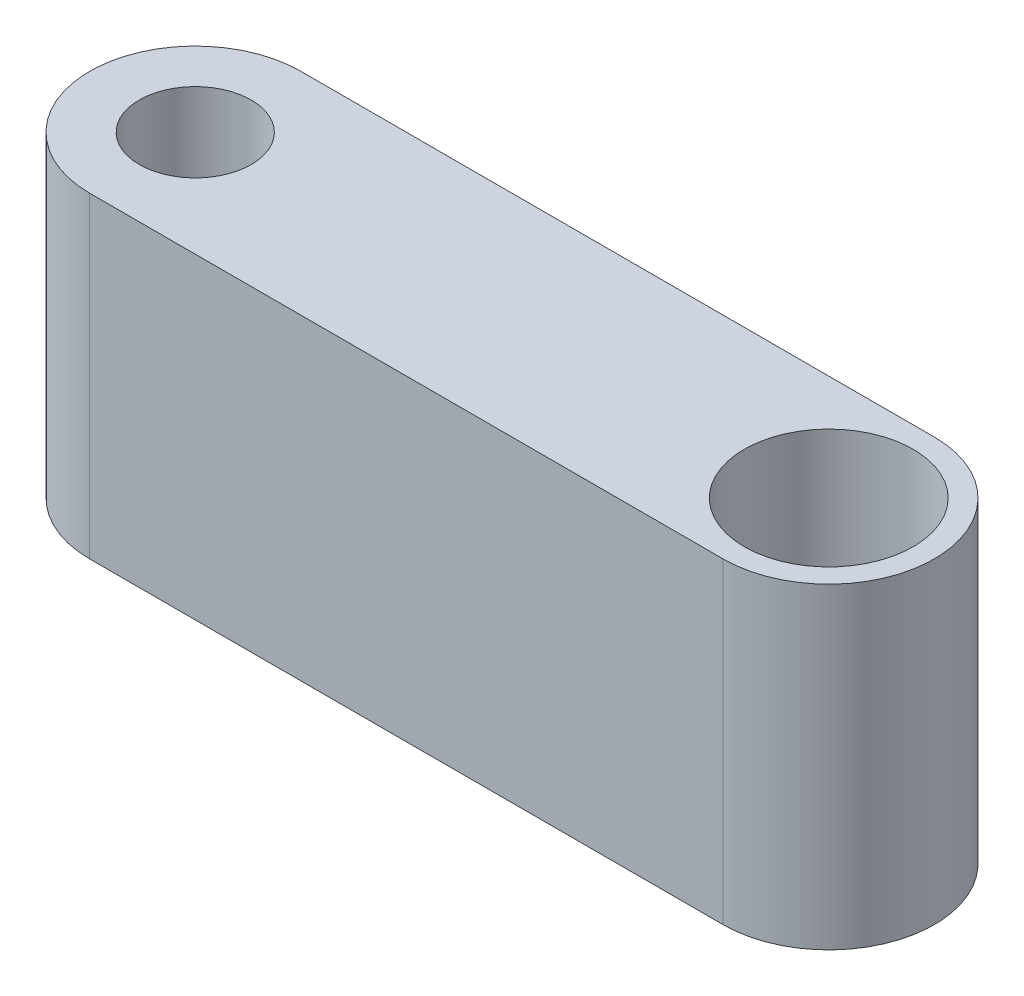
from build123d import *

# Parameters (mm, degrees)
SKETCH2_R           = 0.265
SKETCH2_R_2         = 0.4
BOSS_EXTRUDE1_DEPTH = 1.5


with BuildPart() as part:
    # Sketch2 → Boss-Extrude1 (new body)
    with BuildSketch(Plane(origin=(0, 0, 0), x_dir=(1, 0, 0), z_dir=(0, 1, 0))):
        with BuildLine():
            Line((-19.004941608, 21.102889708), (-16.004941608, 21.102889708))
            ThreePointArc((-16.004941608, 21.102889708), (-15.504941608, 20.602889708), (-16.004941608, 20.102889708))
            Line((-16.004941608, 20.102889708), (-19.004941608, 20.102889708))
            ThreePointArc((-19.004941608, 20.102889708), (-19.504941608, 20.602889708), (-19.004941608, 21.102889708))
        make_face()
        with Locations(Location((-19.004941608, 20.602889708, 0), (0, 0, 270))):
            Circle(SKETCH2_R, mode=Mode.SUBTRACT)
        with Locations(Location((-16.004941608, 20.602889708, 0), (0, 0, 270))):
            Circle(SKETCH2_R_2, mode=Mode.SUBTRACT)
    extrude(amount=BOSS_EXTRUDE1_DEPTH)


solid = part.part
